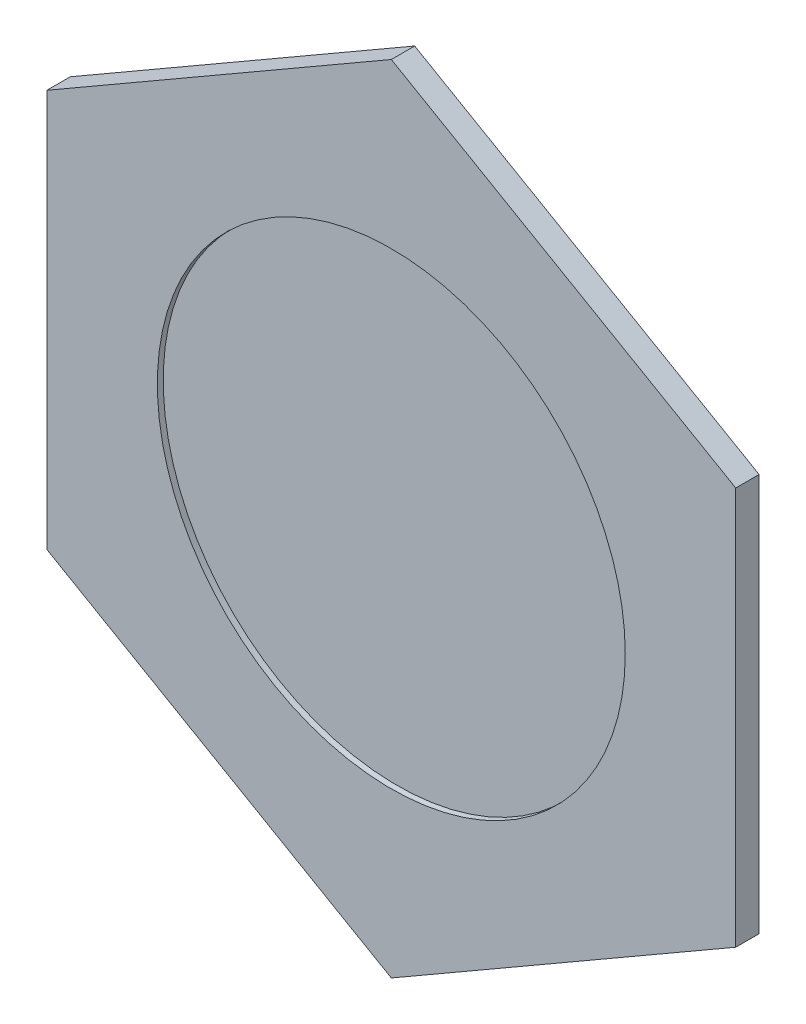
from build123d import *

# Parameters (mm, degrees)
EXTRUDE_1_DEPTH     = 4
SKETCH_2_R          = 40
CUT_EXTRUDE_1_DEPTH = 1


with BuildPart() as part:
    # 스케치1 → 보스-돌출1 (new body)
    with BuildSketch(Plane.XY):
        Polygon((58.889727457, -34), (58.889727457, 34), (0, 68), (-58.889727457, 34), (-58.889727457, -34), (0, -68), align=None)
    extrude(amount=EXTRUDE_1_DEPTH)

    # 스케치2 → 컷-돌출1 (cut)
    with BuildSketch(Plane.XY.offset(4)):
        Circle(SKETCH_2_R)
    extrude(amount=-CUT_EXTRUDE_1_DEPTH, mode=Mode.SUBTRACT)


solid = part.part
